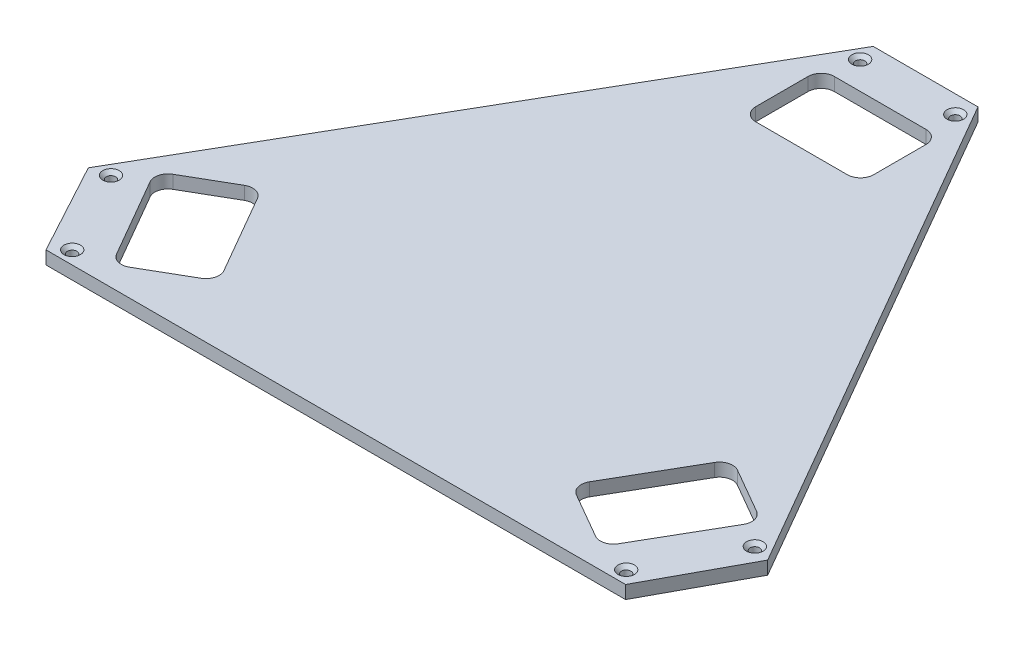
from build123d import *

# Parameters (mm, degrees)
BOSS_EXTRU_1_DEPTH                                = 5
FRAISAGE_POUR_T_TE_FRAIS_E_BOMB_E_M31_D           = 3.6
FRAISAGE_POUR_T_TE_FRAIS_E_BOMB_E_M31_CSINK_D     = 6.3
FRAISAGE_POUR_T_TE_FRAIS_E_BOMB_E_M31_CSINK_ANGLE = 90
ENL_V_MAT_EXTRU_1_DEPTH                           = 10


with BuildPart() as part:
    # Esquisse1 → Boss.-Extru.1 (new body)
    with BuildSketch(Plane(origin=(0, 0, 0), x_dir=(1, 0, 0), z_dir=(0, 1, 0))):
        with BuildLine():
            Line((-32.5, -10.256252677), (-117.5, -157.48057132))
            Line((-117.5, -157.48057132), (-169.461524227, -187.48057132))
            ThreePointArc((-169.461524227, -187.48057132), (-178.328455444, -230.127663943), (-136.961524227, -243.772222566))
            Line((-136.961524227, -243.772222566), (-85, -213.772222566))
            Line((-85, -213.772222566), (85, -213.772222566))
            Line((85, -213.772222566), (136.961524227, -243.772222566))
            ThreePointArc((136.961524227, -243.772222566), (178.328455444, -230.127663943), (169.461524227, -187.48057132))
            Line((169.461524227, -187.48057132), (117.5, -157.48057132))
            Line((117.5, -157.48057132), (32.5, -10.256252677))
            Line((32.5, -10.256252677), (32.5, 49.743747323))
            ThreePointArc((32.5, 49.743747323), (0, 78.746281322), (-32.5, 49.743747323))
            Line((-32.5, 49.743747323), (-32.5, -10.256252677))
        make_face()
        with BuildLine():
            ThreePointArc((-88.937370367, -203.535799534), (-92.731465593, -204.035301647), (-95.767497386, -201.705672515))
            Line((-95.767497386, -201.705672515), (-113.267497386, -171.394783383))
            ThreePointArc((-113.267497386, -171.394783383), (-113.766999499, -167.600688157), (-111.437370367, -164.564656364))
            Line((-111.437370367, -164.564656364), (-94.116862291, -154.564656364))
            ThreePointArc((-94.116862291, -154.564656364), (-90.322767066, -154.065154251), (-87.286735273, -156.394783383))
            Line((-87.286735273, -156.394783383), (-69.786735273, -186.705672515))
            ThreePointArc((-69.786735273, -186.705672515), (-69.28723316, -190.499767741), (-71.616862291, -193.535799534))
            Line((-71.616862291, -193.535799534), (-88.937370367, -203.535799534))
        make_face(mode=Mode.SUBTRACT)
        with BuildLine():
            ThreePointArc((71.616862291, -193.535799534), (69.28723316, -190.499767741), (69.786735273, -186.705672515))
            Line((69.786735273, -186.705672515), (87.286735273, -156.394783383))
            ThreePointArc((87.286735273, -156.394783383), (90.322767066, -154.065154251), (94.116862291, -154.564656364))
            Line((94.116862291, -154.564656364), (111.437370367, -164.564656364))
            ThreePointArc((111.437370367, -164.564656364), (113.766999499, -167.600688157), (113.267497386, -171.394783383))
            Line((113.267497386, -171.394783383), (95.767497386, -201.705672515))
            ThreePointArc((95.767497386, -201.705672515), (92.731465593, -204.035301647), (88.937370367, -203.535799534))
            Line((88.937370367, -203.535799534), (71.616862291, -193.535799534))
        make_face(mode=Mode.SUBTRACT)
        with BuildLine():
            Line((17.5, -35.964601431), (-17.5, -35.964601431))
            ThreePointArc((-17.5, -35.964601431), (-21.035533906, -34.500135337), (-22.5, -30.964601431))
            Line((-22.5, -30.964601431), (-22.5, -10.964601431))
            ThreePointArc((-22.5, -10.964601431), (-21.035533906, -7.429067525), (-17.5, -5.964601431))
            Line((-17.5, -5.964601431), (17.5, -5.964601431))
            ThreePointArc((17.5, -5.964601431), (21.035533906, -7.429067525), (22.5, -10.964601431))
            Line((22.5, -10.964601431), (22.5, -30.964601431))
            ThreePointArc((22.5, -30.964601431), (21.035533906, -34.500135337), (17.5, -35.964601431))
        make_face(mode=Mode.SUBTRACT)
    extrude(amount=BOSS_EXTRU_1_DEPTH)

    # Fraisage pour tête fraisée bombée M31 (through all)
    with Locations(Plane(origin=(18.169872981, 5, -4.564255399), x_dir=(0, 0, 1), z_dir=(0, 1, 0))):
        with Locations((0, 0), (181.304804312, -141.016123537), (213.336477965, -123.795670618), (0, -36.339745962), (181.088690368, 104.551604131), (213.336477965, 87.70428834)):
            CounterSinkHole(FRAISAGE_POUR_T_TE_FRAIS_E_BOMB_E_M31_D / 2, FRAISAGE_POUR_T_TE_FRAIS_E_BOMB_E_M31_CSINK_D / 2, counter_sink_angle=FRAISAGE_POUR_T_TE_FRAIS_E_BOMB_E_M31_CSINK_ANGLE)

    # Esquisse5 → Enlèv. mat.-Extru.1 (cut)
    with BuildSketch(Plane(origin=(0, 5, 0), x_dir=(1, 0, 0), z_dir=(0, 1, 0))):
        with BuildLine():
            Line((-117.5, -157.48057132), (-129.676377575, -178.570675931))
            Line((-129.676377575, -178.570675931), (-110.625797637, -213.772222566))
            Line((-110.625797637, -213.772222566), (-85, -213.772222566))
            add(Edge.make_bspline(
                [(-117.5, -157.48057132), (-151.940688813, -148.613043489), (-277.037698094, -222.560603045), (-150.450766074, -316.414471558), (-56.420377815, -257.105249939), (-85, -213.772222566)],
                knots=[0, 0, 0, 0, 0.411814668, 0.638484528, 1, 1, 1, 1], degree=3))
        make_face()
        with BuildLine():
            Line((-32.5, -10.256252677), (-20, 11.394382418))
            Line((-20, 11.394382418), (20, 11.394382418))
            Line((20, 11.394382418), (32.5, -10.256252677))
            add(Edge.make_bspline(
                [(0, 98.703141202), (74.821178569, 66.789103835), (32.5, -10.256252677)],
                knots=[0, 0, 0, 1, 1, 1], degree=2))
            add(Edge.make_bspline(
                [(0, 98.703141202), (-74.821178569, 66.789103835), (-32.5, -10.256252677)],
                knots=[0, 0, 0, 1, 1, 1], degree=2))
        make_face()
        with BuildLine():
            Line((117.5, -157.48057132), (129.676377575, -178.570675931))
            Line((129.676377575, -178.570675931), (110.625797637, -213.772222566))
            Line((110.625797637, -213.772222566), (85, -213.772222566))
            add(Edge.make_bspline(
                [(117.5, -157.48057132), (151.940688813, -148.613043489), (277.037698094, -222.560603045), (150.450766074, -316.414471558), (56.420377815, -257.105249939), (85, -213.772222566)],
                knots=[0, 0, 0, 0, 0.411814668, 0.638484528, 1, 1, 1, 1], degree=3))
        make_face()
    extrude(amount=-ENL_V_MAT_EXTRU_1_DEPTH, mode=Mode.SUBTRACT)


solid = part.part
